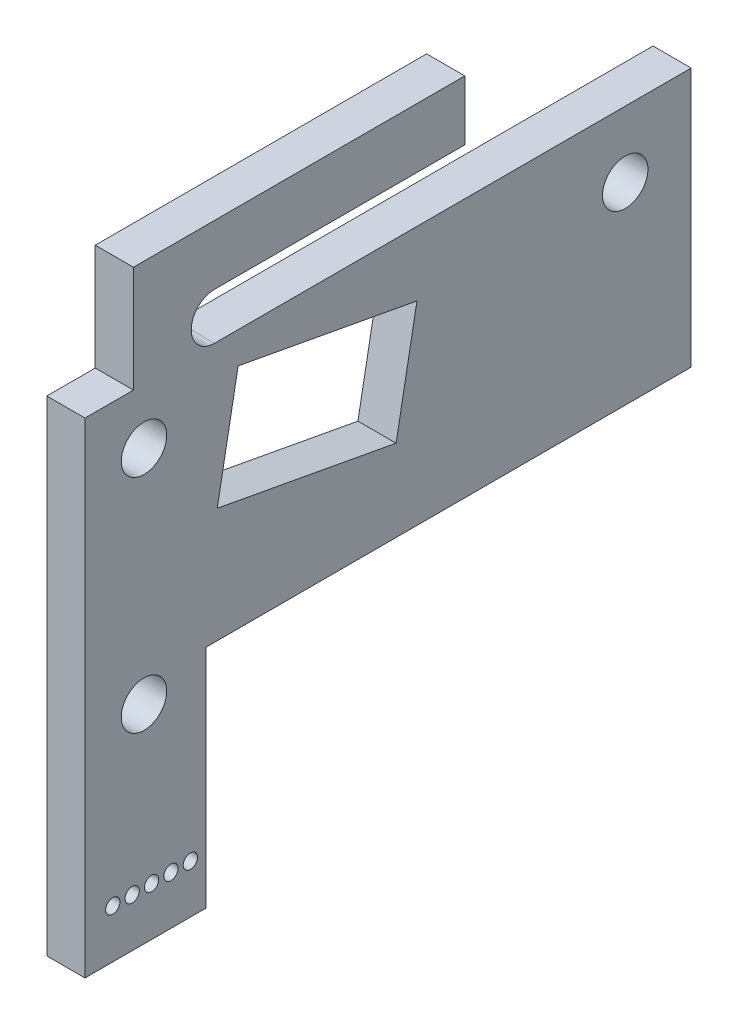
from build123d import *

# Parameters (mm, degrees)
SKETCH1_R           = 2.38125
SKETCH1_R_2         = 0.75
BOSS_EXTRUDE1_DEPTH = 2


with BuildPart() as part:
    # Sketch1 → Boss-Extrude1 (new, symmetric)
    with BuildSketch(Plane(origin=(0, 0, 0), x_dir=(0, 0, -1), z_dir=(1, 0, 0))):
        with BuildLine():
            Line((-56.590412722, 6.909587278), (-51.518608779, 6.909587278))
            Line((-51.518608779, 6.909587278), (-51.518608779, 18.053715602))
            Line((-51.518608779, 18.053715602), (-16.803992093, 18.053715602))
            Line((-16.803992093, 18.053715602), (-16.803992093, 11.79733741))
            Line((-16.803992093, 11.79733741), (-43.018535026, 11.79733741))
            ThreePointArc((-43.018535026, 11.79733741), (-45.462410091, 9.353462344), (-43.018535026, 6.909587278))
            Line((-43.018535026, 6.909587278), (6.909587278, 6.909587278))
            Line((6.909587278, 6.909587278), (6.909587278, -20.222057583))
            Line((6.909587278, -20.222057583), (-43.890412722, -20.222057583))
            Line((-43.890412722, -20.222057583), (-43.890412722, -43.890412722))
            Line((-43.890412722, -43.890412722), (-56.590412722, -43.890412722))
            Line((-56.590412722, -43.890412722), (-56.590412722, 6.909587278))
        make_face()
        Circle(SKETCH1_R, mode=Mode.SUBTRACT)
        with Locations((-45.552958224, -38.810412722)):
            Circle(SKETCH1_R_2, mode=Mode.SUBTRACT)
        with Locations((-47.584958224, -38.810412722)):
            Circle(SKETCH1_R_2, mode=Mode.SUBTRACT)
        with Locations((-49.616958224, -38.810412722)):
            Circle(SKETCH1_R_2, mode=Mode.SUBTRACT)
        with Locations((-51.648958224, -38.810412722)):
            Circle(SKETCH1_R_2, mode=Mode.SUBTRACT)
        with Locations((-50.410128911, -22.137211246)):
            Circle(SKETCH1_R, mode=Mode.SUBTRACT)
        with Locations((-50.410128911, 1.079375692)):
            Circle(SKETCH1_R, mode=Mode.SUBTRACT)
        with Locations((-53.680958224, -38.810412722)):
            Circle(SKETCH1_R_2, mode=Mode.SUBTRACT)
        Polygon((-40.547855017, 3.612408172), (-21.81561352, 0.147494252), (-24.001169646, -11.668200482), (-42.733411143, -8.203286562), align=None, mode=Mode.SUBTRACT)
    extrude(amount=BOSS_EXTRUDE1_DEPTH, both=True)


solid = part.part
